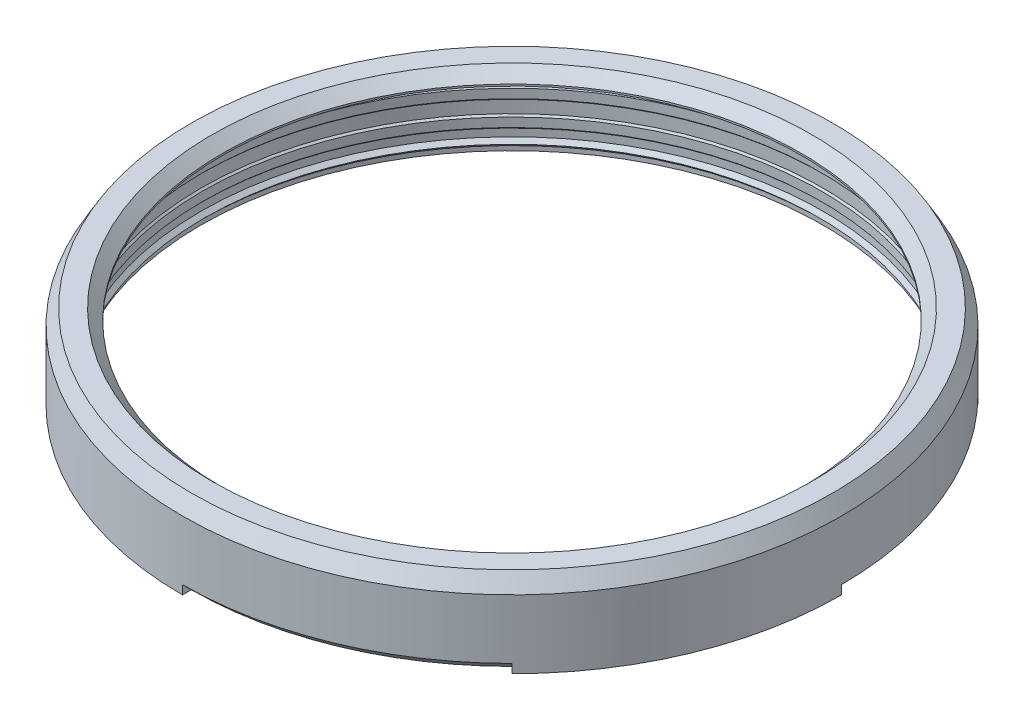
from build123d import *

# Parameters (mm, degrees)
SKETCH_1_R               = 37
EXTRUDE_1_DEPTH          = 2
SKETCH_4_R               = 32.5
CUT_EXTRUDE_1_DEPTH      = 54.272882407
CUT_EXTRUDE_START        = -0.6
SKETCH_5_R               = 37
CUT_EXTRUDE_2_DEPTH      = 0.6
CHAMFER_1_SIZE           = 1.2
CHAMFER_2_SIZE           = 1.732
CHAMFER_2_SIZE2          = 0.999970666
CUT_REVOLVE_1_ANGLE      = 45
PATTERN_CIRCULAR_1_COUNT = 4
SKETCH_7_R               = 33.78
SKETCH_7_R_2             = 33.32
EXTRUDE_2_DEPTH          = 0.5


with BuildPart() as part:
    # 草图1 → 凸台-拉伸1 (new body)
    with BuildSketch(Plane(origin=(0, 0, 0), x_dir=(1, 0, 0), z_dir=(0, 1, 0))):
        with Locations(Location((0, 0, 0), (0, 0, 270))):
            Circle(SKETCH_1_R)
    extrude(amount=EXTRUDE_1_DEPTH)

    # 草图3 → 旋转1 (revolve)
    with BuildSketch(Plane(origin=(0, 0, 0), x_dir=(0.5877852522924704, 0, -0.8090169943749496), z_dir=(0.8090169943749496, 0, 0.5877852522924704)), mode=Mode.PRIVATE) as revolve_1_sk:
        with BuildLine():
            Line((34.93, -8), (34.93, -7.5))
            Line((34.93, -7.5), (34.505, -7.075))
            Line((34.505, -7.075), (34.93, -6.65))
            Line((34.93, -6.65), (34.93, -5.8))
            Line((34.93, -5.8), (34.74, -5.61))
            Line((34.74, -5.61), (34.74, -4.59))
            Line((34.74, -4.59), (34.93, -4.4))
            Line((34.93, -4.4), (34.93, -3))
            Line((34.93, -3), (34.74, -2.81))
            Line((34.74, -2.81), (34.74, -1.79))
            Line((34.74, -1.79), (34.93, -1.6))
            Line((34.93, -1.6), (34.93, -1.4))
            ThreePointArc((34.93, -1.4), (34.519949494, -0.410050506), (33.53, 0))
            Line((33.53, 0), (37, 0))
            Line((37, 0), (37, -8))
            Line((37, -8), (34.93, -8))
        make_face()
    revolve(revolve_1_sk.sketch.rotate(Axis((0, 0, 0), (0, 1, 0)), 306), axis=Axis((0, 0, 0), (0, 1, 0)))

    # 草图4 → 切除-拉伸1 (cut, through all)
    with BuildSketch(Plane(origin=(0, 2, 0), x_dir=(1, 0, 0), z_dir=(0, 1, 0))):
        with Locations(Location((0, 0, 0), (0, 0, 270))):
            Circle(SKETCH_4_R)
    extrude(amount=-CUT_EXTRUDE_1_DEPTH, mode=Mode.SUBTRACT)

    # 草图5 → 切除-拉伸2 (cut)
    with BuildSketch(Plane(origin=(0, 2, 0), x_dir=(1, 0, 0), z_dir=(0, 1, 0)).offset(CUT_EXTRUDE_START)):
        Circle(SKETCH_5_R)
    extrude(amount=CUT_EXTRUDE_2_DEPTH, mode=Mode.SUBTRACT)

    # 倒角1
    chamfer_1_edges = [part.edges().sort_by_distance(p)[0] for p in [
        (0, 1.4, -32.5),
    ]]
    chamfer(chamfer_1_edges, length=CHAMFER_1_SIZE)

    # 倒角2
    chamfer_2_edges = [part.edges().sort_by_distance(p)[0] for p in [
        (0, 1.4, -37),
    ]]
    chamfer_2_side = [part.faces().sort_by_distance(p)[0] for p in [
        (-26.162950904, -3.3, -26.162950904),
    ]]
    chamfer(chamfer_2_edges, length=CHAMFER_2_SIZE, length2=CHAMFER_2_SIZE2, reference=chamfer_2_side[0])

    # 草图6 → 切除-旋转1 (revolve, cut)
    with BuildSketch(Plane.XY):
        Polygon((37, -8), (37, -7), (36, -8), align=None)
    cut_revolve_1 = revolve(axis=Axis((0, 0, 0), (0, 1, 0)), revolution_arc=CUT_REVOLVE_1_ANGLE, mode=Mode.SUBTRACT)

    # 阵列(圆周)1: 切除-旋转1 ×4 about axis
    pattern_circular_1_axis = Axis((0, 0, 0), (0, 1, 0))
    for i in range(1, PATTERN_CIRCULAR_1_COUNT):
        add(cut_revolve_1.rotate(pattern_circular_1_axis, i * 360 / PATTERN_CIRCULAR_1_COUNT), mode=Mode.SUBTRACT)

    # 草图7 → 凸台-拉伸2 (add)
    with BuildSketch(Plane.XZ):
        Circle(SKETCH_7_R)
        with Locations(Location((0, 0, 0), (0, 0, 270))):
            Circle(SKETCH_7_R_2, mode=Mode.SUBTRACT)
    extrude(amount=EXTRUDE_2_DEPTH)


solid = part.part
